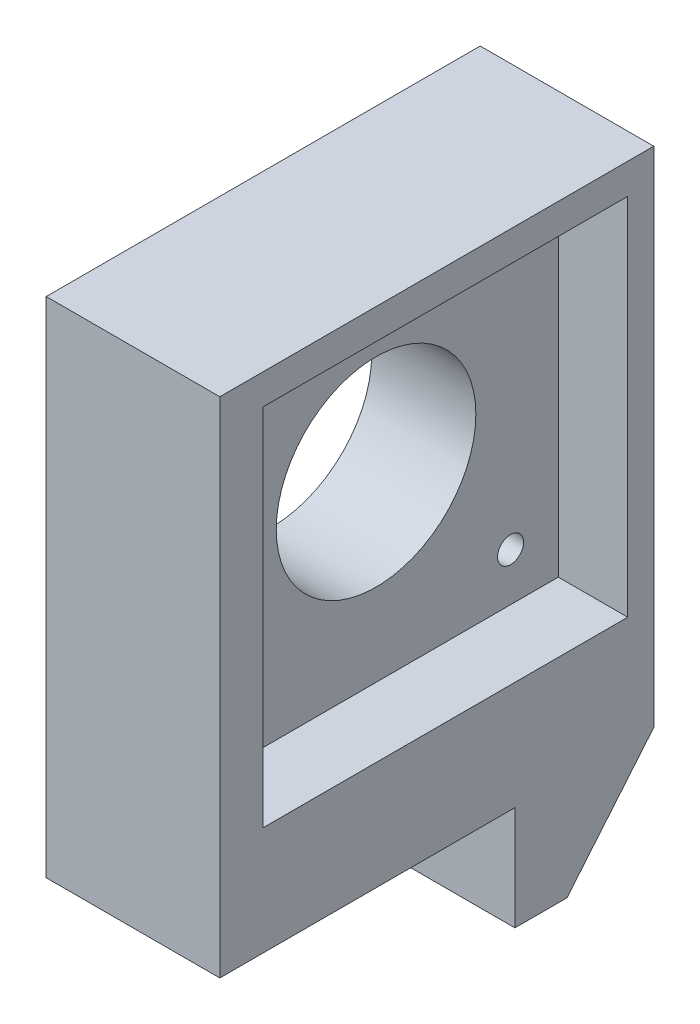
from build123d import *

# Parameters (mm, degrees)
SKETCH1_W           = 20
SKETCH1_H           = 50
BOSS_EXTRUDE1_DEPTH = 70
SKETCH2_R           = 1.5
SKETCH2_R_2         = 11.5
CUT_EXTRUDE2_DEPTH  = 60
SKETCH4_W           = 34
SKETCH4_H           = 12
CUT_EXTRUDE3_DEPTH  = 60
SKETCH8_R           = 2
CUT_EXTRUDE5_DEPTH  = 15
SKETCH9_W           = 42
SKETCH9_H           = 42
CUT_EXTRUDE6_DEPTH  = 8
CUT_EXTRUDE8_DEPTH  = 30
SKETCH17_R          = 3.5
CUT_EXTRUDE13_DEPTH = 9.18109305
SKETCH18_R          = 1.5
CUT_EXTRUDE14_DEPTH = 7


with BuildPart() as part:
    # Sketch1 → Boss-Extrude1 (new body)
    with BuildSketch(Plane(origin=(0, 0, 0), x_dir=(1, 0, 0), z_dir=(0, 1, 0))):
        with Locations((-10, -25)):
            Rectangle(SKETCH1_W, SKETCH1_H)
    extrude(amount=BOSS_EXTRUDE1_DEPTH)

    # Sketch2 → Cut-Extrude2 (cut)
    with BuildSketch(Plane(origin=(0, 0, 0), x_dir=(0, 0, -1), z_dir=(1, 0, 0))):
        with Locations((-8.5, 61)):
            Circle(SKETCH2_R)
        with Locations((-24, 45.5)):
            Circle(SKETCH2_R_2)
        with Locations((-8.5, 30)):
            Circle(SKETCH2_R)
        with Locations((-39.5, 30)):
            Circle(SKETCH2_R)
        with Locations((-39.5, 61)):
            Circle(SKETCH2_R)
    extrude(amount=-CUT_EXTRUDE2_DEPTH, mode=Mode.SUBTRACT)

    # Sketch4 → Cut-Extrude3 (cut)
    with BuildSketch(Plane(origin=(0, 0, 0), x_dir=(0, 0, -1), z_dir=(1, 0, 0))):
        with Locations((-33, 6)):
            Rectangle(SKETCH4_W, SKETCH4_H)
    extrude(amount=-CUT_EXTRUDE3_DEPTH, mode=Mode.SUBTRACT)

    # Sketch8 → Cut-Extrude5 (cut)
    with BuildSketch(Plane(origin=(0, 0, 0), x_dir=(-1, 0, 0), z_dir=(0, 0, -1))):
        with Locations((15, 6)):
            Circle(SKETCH8_R)
        with Locations((5, 6)):
            Circle(SKETCH8_R)
    extrude(amount=-CUT_EXTRUDE5_DEPTH, mode=Mode.SUBTRACT)

    # Sketch9 → Cut-Extrude6 (cut)
    with BuildSketch(Plane(origin=(0, 0, 0), x_dir=(0, 0, -1), z_dir=(1, 0, 0))):
        with Locations((-24, 45.5)):
            Rectangle(SKETCH9_W, SKETCH9_H)
    extrude(amount=-CUT_EXTRUDE6_DEPTH, mode=Mode.SUBTRACT)

    # Sketch11 → Cut-Extrude8 (cut)
    with BuildSketch(Plane(origin=(0, 0, 0), x_dir=(0, 0, -1), z_dir=(1, 0, 0))):
        Polygon((-10, 0), (0, 0), (0, 12), align=None)
    extrude(amount=-CUT_EXTRUDE8_DEPTH, mode=Mode.SUBTRACT)

    # Sketch17 → Cut-Extrude13 (cut)
    with BuildSketch(Plane(origin=(0, 0, 0), x_dir=(-1, 0, 0), z_dir=(0, 0, -1))):
        with Locations((15, 6)):
            Circle(SKETCH17_R)
        with Locations((5, 6)):
            Circle(SKETCH17_R)
    extrude(amount=-CUT_EXTRUDE13_DEPTH, mode=Mode.SUBTRACT)

    # Sketch18 → Cut-Extrude14 (cut)
    with BuildSketch(Plane.ZY.offset(20)):
        with Locations((46, 20)):
            Circle(SKETCH18_R)
        with Locations((39, 20)):
            Circle(SKETCH18_R)
    extrude(amount=-CUT_EXTRUDE14_DEPTH, mode=Mode.SUBTRACT)


solid = part.part
